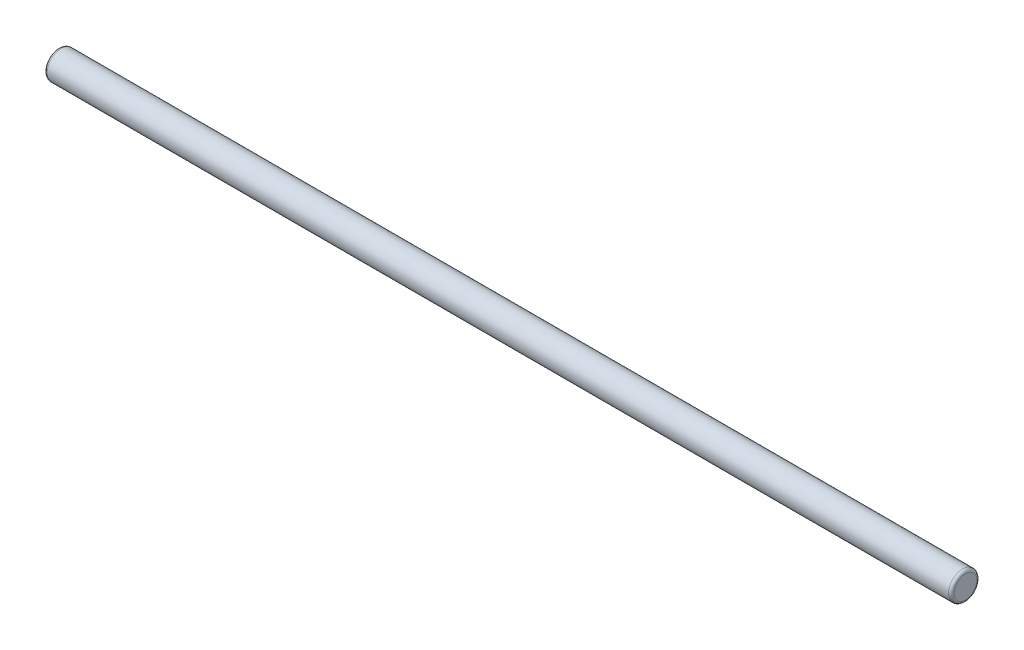
from build123d import *

# Parameters (mm, degrees)
SKETCH1_R           = 12.7
BOSS_EXTRUDE1_DEPTH = 812.8
FILLET1_R           = 2.54


with BuildPart() as part:
    # Sketch1 → Boss-Extrude1 (new body)
    with BuildSketch(Plane(origin=(0, 0, 0), x_dir=(0, 0, -1), z_dir=(1, 0, 0))):
        Circle(SKETCH1_R)
    extrude(amount=-BOSS_EXTRUDE1_DEPTH)

    # Fillet1
    fillet1_edges = [part.edges().sort_by_distance(p)[0] for p in [
        (0, 0, 12.7),
        (-812.8, 0, 12.7),
    ]]
    fillet(fillet1_edges, radius=FILLET1_R)


solid = part.part
